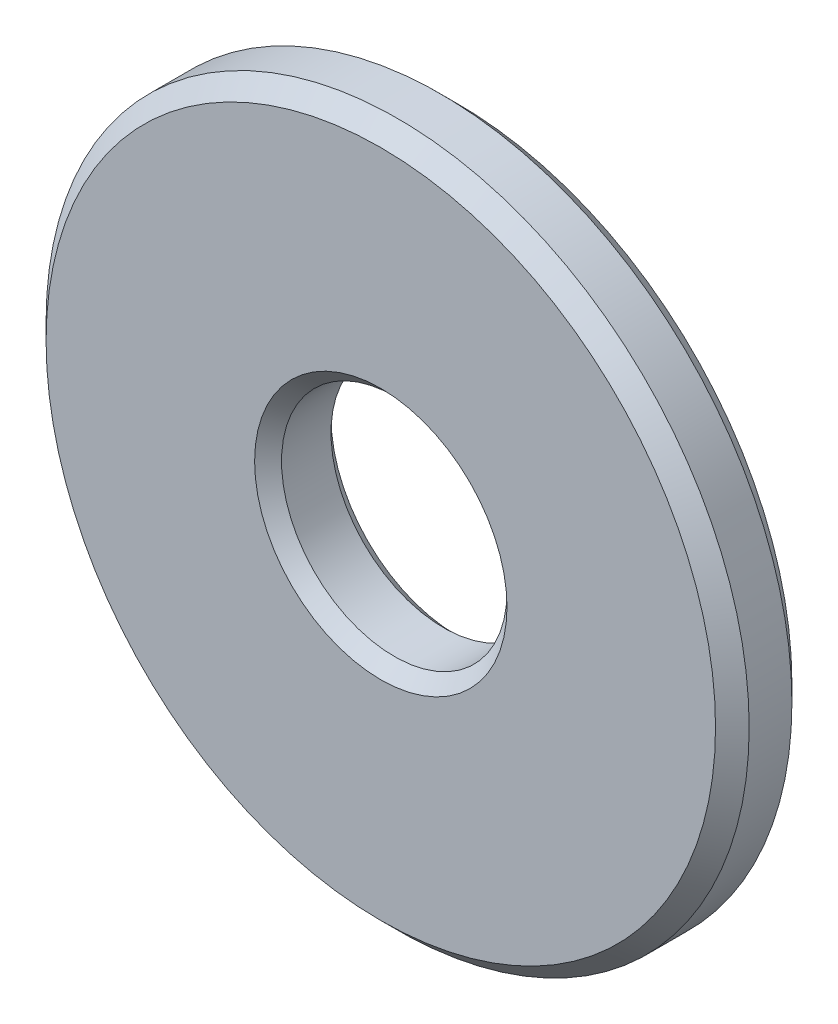
from build123d import *

# Parameters (mm, degrees)
SKETCH2_R           = 26.533992322
BOSS_EXTRUDE1_DEPTH = 5.7658
CHAMFER1_SIZE       = 1.27
SKETCH3_R           = 8.509
CUT_EXTRUDE1_DEPTH  = 5.7658
CHAMFER2_SIZE       = 1.016


with BuildPart() as part:
    # Sketch2 → Boss-Extrude1 (new body)
    with BuildSketch(Plane.XY):
        with Locations(Location((0, 0, 0), (0, 0, 180))):
            Circle(SKETCH2_R)
    extrude(amount=BOSS_EXTRUDE1_DEPTH)

    # Chamfer1
    chamfer1_edges = [part.edges().sort_by_distance(p)[0] for p in [
        (26.533992322, 0, 0),
        (26.533992322, 0, 5.7658),
    ]]
    chamfer(chamfer1_edges, length=CHAMFER1_SIZE)

    # Sketch3 → Cut-Extrude1 (cut)
    with BuildSketch(Plane.XY.offset(5.7658)):
        Circle(SKETCH3_R)
    extrude(amount=-CUT_EXTRUDE1_DEPTH, mode=Mode.SUBTRACT)

    # Chamfer2
    chamfer2_edges = [part.edges().sort_by_distance(p)[0] for p in [
        (-8.509, 0, 0),
        (-8.509, 0, 5.7658),
    ]]
    chamfer(chamfer2_edges, length=CHAMFER2_SIZE)


solid = part.part
